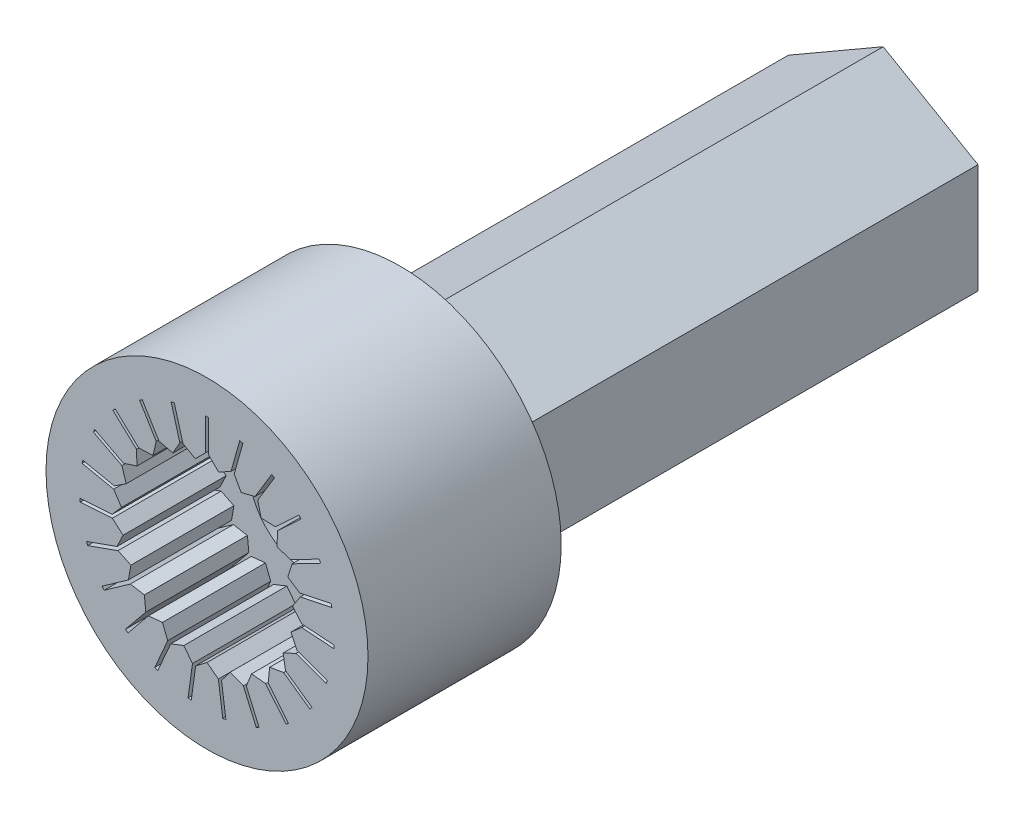
from build123d import *

# Parameters (mm, degrees)
EXTRUDE_1_DEPTH     = 15
SKETCH_6_R          = 5
EXTRUDE_3_DEPTH     = 6
CUT_EXTRUDE_5_DEPTH = 3.2
CHAMFER_1_SIZE      = 1
SKETCH_7_R          = 1.9
CUT_EXTRUDE_6_DEPTH = 23.158519806


with BuildPart() as part:
    # ｽｹｯﾁ1 → ﾎﾞｽ - 押し出し1 (new body)
    with BuildSketch(Plane.XY):
        Polygon((0, 3.4), (-2.944486373, 1.7), (-2.944486373, -1.7), (0, -3.4), (2.944486373, -1.7), (2.944486373, 1.7), align=None)
    extrude(amount=EXTRUDE_1_DEPTH)

    # ｽｹｯﾁ6 → ﾎﾞｽ - 押し出し3 (add)
    with BuildSketch(Plane.XY.offset(15)):
        Circle(SKETCH_6_R)
    extrude(amount=EXTRUDE_3_DEPTH)

    # ｽｹｯﾁ5 → ｶｯﾄ - 押し出し5 (cut)
    with BuildSketch(Plane.XY.offset(21)):
        Polygon((-0.05, 2.95), (-0.05, 3.95), (0.05, 3.95), (0.05, 2.95), (0.362514094, 2.637485906), (0.747754611, 2.854095836), (1.017551382, 3.817013124), (1.11384311, 3.790033446), (0.844046339, 2.827116159), (1.060656269, 2.441875642), (1.490051682, 2.546516441), (2.009635632, 3.400935845), (2.095077573, 3.34897745), (1.575493623, 2.494558046), (1.680134421, 2.065162633), (2.121838437, 2.050073571), (2.852674402, 2.732626714), (2.920929716, 2.659543117), (2.190093752, 1.976989974), (2.17500469, 1.535285958), (2.596258142, 1.401586122), (3.484143361, 1.86165116), (3.530149865, 1.772862638), (2.642264646, 1.3127976), (2.50856481, 0.891544148), (2.878125258, 0.649149443), (3.857209346, 0.852605456), (3.877554947, 0.754697047), (2.898470859, 0.551241034), (2.656076155, 0.181680586), (2.94653499, -0.151431681), (3.944203759, -0.219674094), (3.937379518, -0.319440971), (2.939710748, -0.251198558), (2.606598481, -0.541657393), (2.796413701, -0.94078181), (3.738674623, -1.275661422), (3.705186662, -1.369887514), (2.76292574, -1.035007902), (2.363801323, -1.224823122), (2.4388952, -1.660358456), (3.255865093, -2.237038778), (3.198197061, -2.318735767), (2.381227168, -1.742055445), (1.945691834, -1.817149322), (1.900495, -2.25679391), (2.531582945, -3.032505201), (2.454011816, -3.095613995), (1.822923871, -2.319902705), (1.383279283, -2.274705871), (1.22114378, -2.685853285), (1.61954487, -3.603064586), (1.52782374, -3.642904695), (1.12942265, -2.725693394), (0.718275236, -2.563557891), (0.451225912, -2.915715208), (0.587392561, -3.906401154), (0.488323967, -3.920017819), (0.352157318, -2.929331873), (0, -2.66228255), (-0.352157318, -2.929331873), (-0.488323967, -3.920017819), (-0.587392561, -3.906401154), (-0.451225912, -2.915715208), (-0.718275236, -2.563557891), (-1.12942265, -2.725693394), (-1.52782374, -3.642904695), (-1.61954487, -3.603064586), (-1.22114378, -2.685853285), (-1.383279283, -2.274705871), (-1.822923871, -2.319902705), (-2.454011816, -3.095613995), (-2.531582945, -3.032505201), (-1.900495, -2.25679391), (-1.945691834, -1.817149322), (-2.381227168, -1.742055445), (-3.198197061, -2.318735767), (-3.255865093, -2.237038778), (-2.4388952, -1.660358456), (-2.363801323, -1.224823122), (-2.76292574, -1.035007902), (-3.705186662, -1.369887514), (-3.738674623, -1.275661422), (-2.796413701, -0.94078181), (-2.606598481, -0.541657393), (-2.939710748, -0.251198558), (-3.937379518, -0.319440971), (-3.944203759, -0.219674094), (-2.94653499, -0.151431681), (-2.656076155, 0.181680586), (-2.898470859, 0.551241034), (-3.877554947, 0.754697047), (-3.857209346, 0.852605456), (-2.878125258, 0.649149443), (-2.50856481, 0.891544148), (-2.642264646, 1.3127976), (-3.530149865, 1.772862638), (-3.484143361, 1.86165116), (-2.596258142, 1.401586122), (-2.17500469, 1.535285958), (-2.190093752, 1.976989974), (-2.920929716, 2.659543117), (-2.852674402, 2.732626714), (-2.121838437, 2.050073571), (-1.680134421, 2.065162633), (-1.575493623, 2.494558046), (-2.095077573, 3.34897745), (-2.009635632, 3.400935845), (-1.490051682, 2.546516441), (-1.060656269, 2.441875642), (-0.844046339, 2.827116159), (-1.11384311, 3.790033446), (-1.017551382, 3.817013124), (-0.747754611, 2.854095836), (-0.362514094, 2.637485906), align=None)
    extrude(amount=-CUT_EXTRUDE_5_DEPTH, mode=Mode.SUBTRACT)

    # 面取り1
    chamfer_1_edges = [part.edges().sort_by_distance(p)[0] for p in [
        (-2.944486373, 0, 15),
        (-1.472243186, -2.55, 15),
        (1.472243186, -2.55, 15),
        (2.944486373, 0, 15),
        (1.472243186, 2.55, 15),
        (-1.472243186, 2.55, 15),
    ]]
    chamfer(chamfer_1_edges, length=CHAMFER_1_SIZE)

    # ｽｹｯﾁ7 → ｶｯﾄ - 押し出し6 (cut, through all)
    with BuildSketch(Plane(origin=(0, 0, 0), x_dir=(-1, 0, 0), z_dir=(0, 0, -1))):
        Circle(SKETCH_7_R)
    extrude(amount=-CUT_EXTRUDE_6_DEPTH, mode=Mode.SUBTRACT)


solid = part.part
